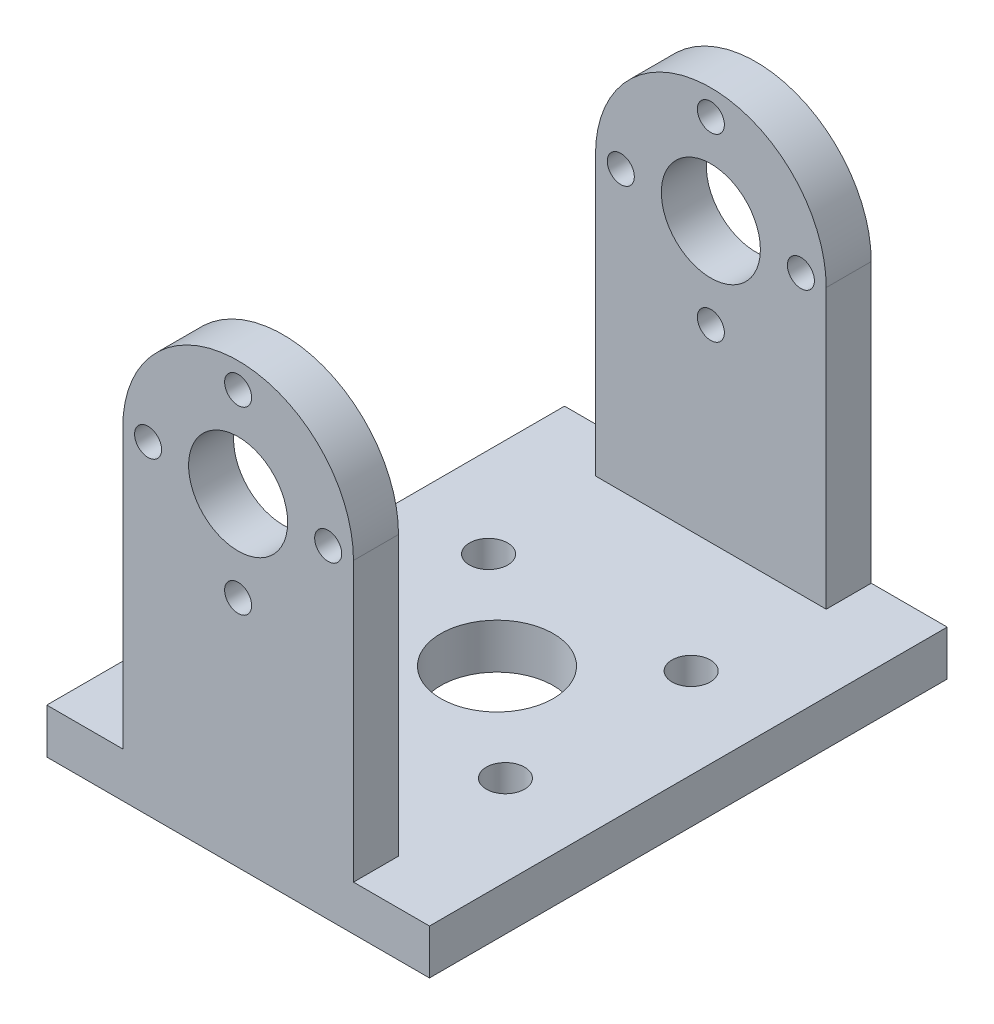
from build123d import *

# Parameters (mm, degrees)
SKETCH1_R           = 1.2
SKETCH1_R_2         = 4.4
BOSS_EXTRUDE1_DEPTH = 4
SKETCH3_W           = 34
SKETCH3_H           = 46
SKETCH3_R           = 5
SKETCH3_R_2         = 1.7
BOSS_EXTRUDE3_DEPTH = 4


with BuildPart() as part:
    # Sketch1 → Boss-Extrude1 (new body)
    with BuildSketch(Plane.XY):
        with BuildLine():
            Line((-10.25, -28.75), (10.25, -28.75))
            Line((10.25, -28.75), (10.25, 0))
            ThreePointArc((10.25, 0), (0, 10.25), (-10.25, 0))
            Line((-10.25, 0), (-10.25, -28.75))
        make_face()
        with Locations((0, 8)):
            Circle(SKETCH1_R, mode=Mode.SUBTRACT)
        with Locations((-8, 0)):
            Circle(SKETCH1_R, mode=Mode.SUBTRACT)
        with Locations((0, -8)):
            Circle(SKETCH1_R, mode=Mode.SUBTRACT)
        with Locations((8, 0)):
            Circle(SKETCH1_R, mode=Mode.SUBTRACT)
        Circle(SKETCH1_R_2, mode=Mode.SUBTRACT)
    boss_extrude1 = extrude(amount=BOSS_EXTRUDE1_DEPTH)

    # Sketch3 → Boss-Extrude3 (add)
    with BuildSketch(Plane(origin=(0, -28.75, 0), x_dir=(-1, 0, 0), z_dir=(0, -1, 0))):
        with Locations((0, -23)):
            Rectangle(SKETCH3_W, SKETCH3_H)
        with Locations(Location((0, -23, 0), (0, 0, 180))):
            Circle(SKETCH3_R, mode=Mode.SUBTRACT)
        with Locations(Location((-9, -14.75, 0), (0, 0, 180))):
            Circle(SKETCH3_R_2, mode=Mode.SUBTRACT)
        with Locations(Location((9, -14.75, 0), (0, 0, 180))):
            Circle(SKETCH3_R_2, mode=Mode.SUBTRACT)
        with Locations(Location((9, -31.25, 0), (0, 0, 180))):
            Circle(SKETCH3_R_2, mode=Mode.SUBTRACT)
        with Locations(Location((-9, -31.25, 0), (0, 0, 180))):
            Circle(SKETCH3_R_2, mode=Mode.SUBTRACT)
    extrude(amount=-BOSS_EXTRUDE3_DEPTH)

    # Mirror1: Boss-Extrude1 across plane
    add(boss_extrude1.mirror(Plane.XY.offset(23)))


solid = part.part
